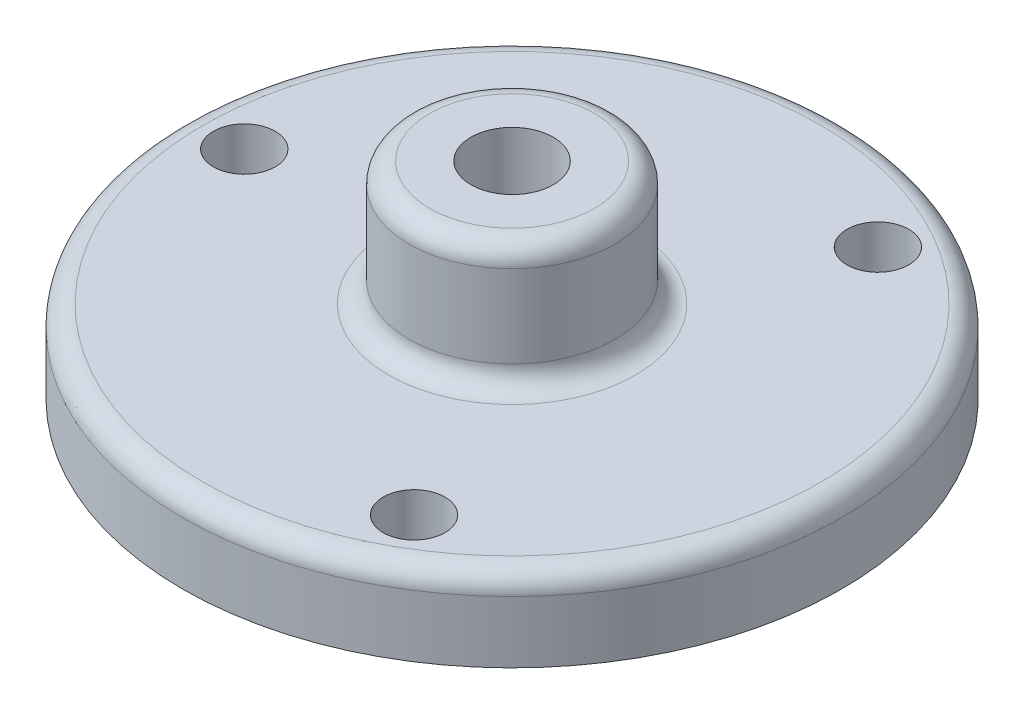
from build123d import *

# Parameters (mm, degrees)
SKETCH1_R               = 16
BOSS_EXTRUDE1_DEPTH     = 4
SKETCH2_R               = 5
BOSS_EXTRUDE2_DEPTH     = 6
CUT_EXTRUDE1_REACH      = 25.409
SKETCH3_R               = 1.5
SKETCH4_R               = 8
BOSS_EXTRUDE3_DEPTH     = 1
FILLET1_R               = 1
CUT_EXTRUDE2_DEPTH      = 26.159491314
CUT_EXTRUDE2_DEPTH_BACK = 26.159491314
SKETCH5_R               = 2


with BuildPart() as part:
    # Sketch1 → Boss-Extrude1 (new body)
    with BuildSketch(Plane(origin=(0, 0, 0), x_dir=(1, 0, 0), z_dir=(0, 1, 0))):
        with Locations(Location((0, 0, 0), (0, 0, 270))):
            Circle(SKETCH1_R)
    extrude(amount=BOSS_EXTRUDE1_DEPTH)

    # Sketch2 → Boss-Extrude2 (add)
    with BuildSketch(Plane(origin=(0, 4, 0), x_dir=(1, 0, 0), z_dir=(0, 1, 0))):
        with Locations(Location((0, 0, 0), (0, 0, 270))):
            Circle(SKETCH2_R)
    extrude(amount=BOSS_EXTRUDE2_DEPTH)

    # Sketch3 → Cut-Extrude1 (cut, up to next)
    with BuildSketch(Plane(origin=(0, 4, 0), x_dir=(1, 0, 0), z_dir=(0, 1, 0)), mode=Mode.PRIVATE) as cut_extrude1_sk1:
        with Locations(Location((-13, 0, 0), (0, 0, 270))):
            Circle(SKETCH3_R)
    cut_extrude1_tool1 = extrude(cut_extrude1_sk1.sketch, amount=-CUT_EXTRUDE1_REACH, mode=Mode.PRIVATE) & part.part
    # Sketch3 → Cut-Extrude1 (cut, up to next)
    with BuildSketch(Plane(origin=(0, 4, 0), x_dir=(1, 0, 0), z_dir=(0, 1, 0)), mode=Mode.PRIVATE) as cut_extrude1_sk2:
        with Locations(Location((6.5, 11.258330249, 0), (0, 0, 270))):
            Circle(SKETCH3_R)
    cut_extrude1_tool2 = extrude(cut_extrude1_sk2.sketch, amount=-CUT_EXTRUDE1_REACH, mode=Mode.PRIVATE) & part.part
    # Sketch3 → Cut-Extrude1 (cut, up to next)
    with BuildSketch(Plane(origin=(0, 4, 0), x_dir=(1, 0, 0), z_dir=(0, 1, 0)), mode=Mode.PRIVATE) as cut_extrude1_sk3:
        with Locations(Location((6.5, -11.258330249, 0), (0, 0, 270))):
            Circle(SKETCH3_R)
    cut_extrude1_tool3 = extrude(cut_extrude1_sk3.sketch, amount=-CUT_EXTRUDE1_REACH, mode=Mode.PRIVATE) & part.part
    add(cut_extrude1_tool1.solids().sort_by_distance((-13, 4, 0))[0], mode=Mode.SUBTRACT)
    add(cut_extrude1_tool2.solids().sort_by_distance((6.5, 4, -11.25833))[0], mode=Mode.SUBTRACT)
    add(cut_extrude1_tool3.solids().sort_by_distance((6.5, 4, 11.25833))[0], mode=Mode.SUBTRACT)

    # Sketch4 → Boss-Extrude3 (add)
    with BuildSketch(Plane.XZ):
        with Locations(Location((0, 0, 0), (0, 0, 270))):
            Circle(SKETCH4_R)
    extrude(amount=BOSS_EXTRUDE3_DEPTH)

    # Fillet1
    fillet1_edges = [part.edges().sort_by_distance(p)[0] for p in [
        (0, 4, -16),
        (0, 4, -5),
        (0, 10, -5),
    ]]
    fillet(fillet1_edges, radius=FILLET1_R)

    # Sketch5 → Cut-Extrude2 (cut, two sides: drawn at the far end of the back side and taken through both)
    with BuildSketch(Plane(origin=(0, 10, 0), x_dir=(1, 0, 0), z_dir=(0, 1, 0)).offset(-CUT_EXTRUDE2_DEPTH_BACK)):
        with Locations(Location((0, 0, 0), (0, 0, 270))):
            Circle(SKETCH5_R)
    extrude(amount=CUT_EXTRUDE2_DEPTH + CUT_EXTRUDE2_DEPTH_BACK, mode=Mode.SUBTRACT)


solid = part.part
